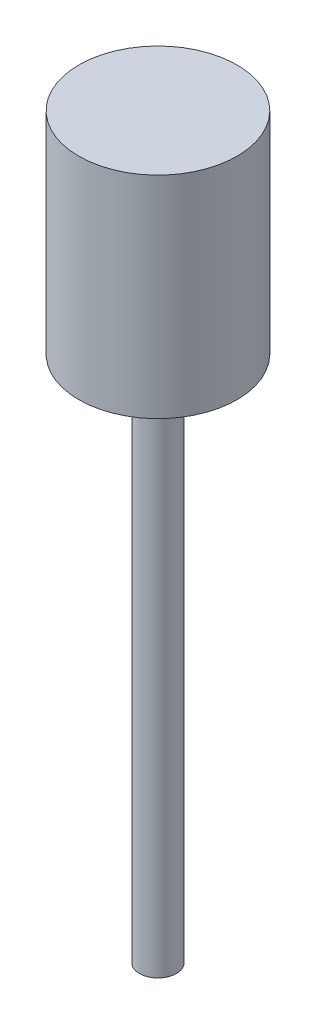
from build123d import *

# Parameters (mm, degrees)
SKETCH1_R           = 4.445
BOSS_EXTRUDE1_DEPTH = 127
SKETCH2_R           = 19.05
BOSS_EXTRUDE2_DEPTH = 50.8


with BuildPart() as part:
    # Sketch1 → Boss-Extrude1 (new body)
    with BuildSketch(Plane(origin=(0, 0, 0), x_dir=(1, 0, 0), z_dir=(0, 1, 0))):
        with Locations(Location((0, 0, 0), (0, 0, 270))):
            Circle(SKETCH1_R)
    extrude(amount=BOSS_EXTRUDE1_DEPTH)

    # Sketch2 → Boss-Extrude2 (add)
    with BuildSketch(Plane(origin=(0, 127, 0), x_dir=(1, 0, 0), z_dir=(0, 1, 0))):
        with Locations(Location((0, 0, 0), (0, 0, 270))):
            Circle(SKETCH2_R)
    extrude(amount=BOSS_EXTRUDE2_DEPTH)


solid = part.part
